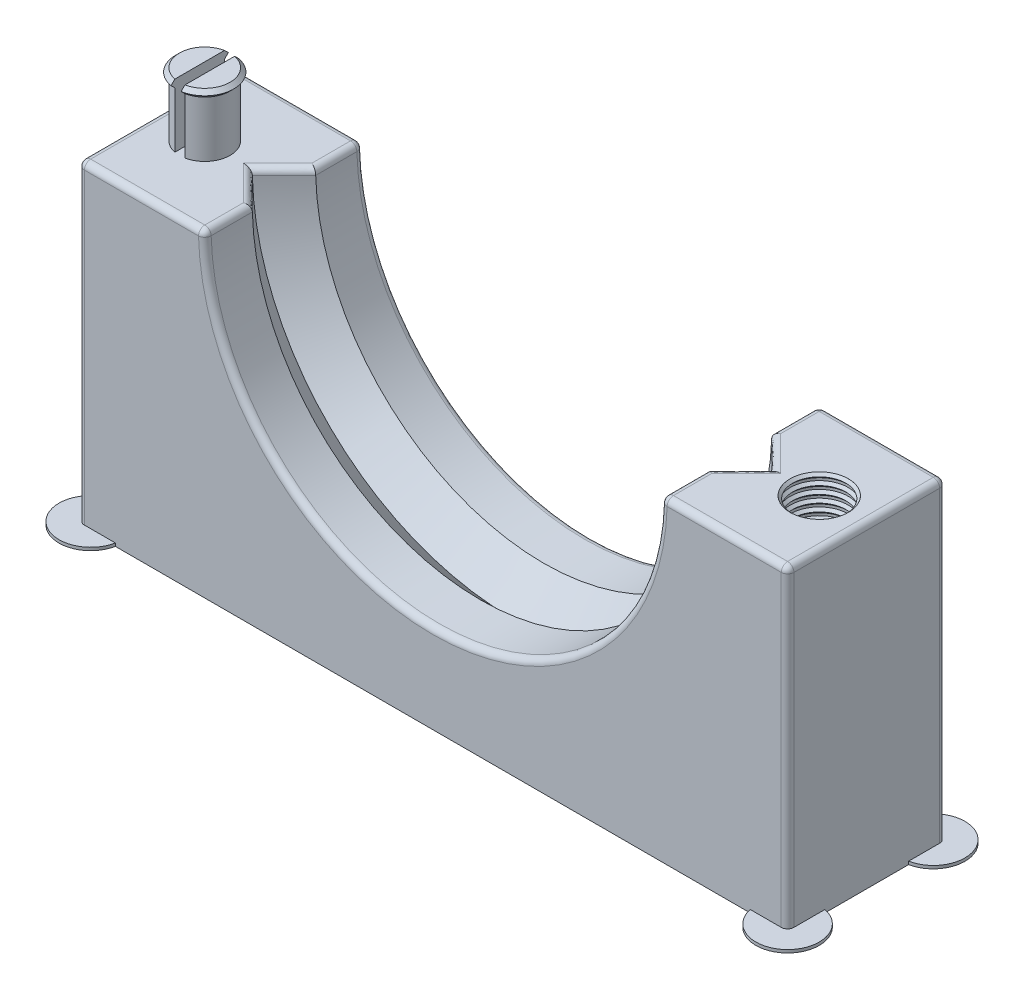
from build123d import *

# Parameters (mm, degrees)
BOSS_EXTRUDE1_DEPTH = 15.875
SKETCH6_R           = 2.921
CUT_EXTRUDE2_DEPTH  = 9.525
CUT_EXTRUDE3_REACH  = 56.481
SKETCH16_W          = 1.016
SKETCH16_H          = 11.1836739
FILLET1_R           = 0.635
SKETCH17_R          = 3.175
BOSS_EXTRUDE2_DEPTH = 0.3


with BuildPart() as part:
    # Sketch1 → Boss-Extrude1 (new body)
    with BuildSketch(Plane.XY):
        with BuildLine():
            Line((-35.56, 0), (35.56, 0))
            Line((35.56, 0), (35.56, 31.75))
            Line((35.56, 31.75), (22.86, 31.75))
            ThreePointArc((22.86, 31.75), (0, 8.89), (-22.86, 31.75))
            Line((-22.86, 31.75), (-35.56, 31.75))
            Line((-35.56, 31.75), (-35.56, 0))
        make_face()
    extrude(amount=BOSS_EXTRUDE1_DEPTH)

    # Sketch2 → Cut-Revolve1 (revolve, cut)
    with BuildSketch(Plane(origin=(0, 31.75, 0), x_dir=(1, 0, 0), z_dir=(0, 1, 0))):
        Polygon((22.86, -11.1125), (26.035, -7.9375), (22.86, -4.7625), align=None)
    revolve(axis=Axis((0, 31.75, 0), (0, 0, 1)), mode=Mode.SUBTRACT)

    # Sketch6 → Cut-Extrude2 (cut)
    with BuildSketch(Plane(origin=(0, 31.75, 0), x_dir=(1, 0, 0), z_dir=(0, 1, 0))):
        with Locations(Location((30.7975, -7.9375, 0), (0, 0, 180))):
            Circle(SKETCH6_R)
    extrude(amount=-CUT_EXTRUDE2_DEPTH, mode=Mode.SUBTRACT)

    # Sketch15 → Revolve2 (revolve)
    with BuildSketch(Plane.XY.offset(7.9375), mode=Mode.PRIVATE) as revolve2_sk:
        Polygon((-33.3375, 31.75), (-33.3375, 37.338), (-33.7185, 37.719), (-33.3375, 38.1), (-30.7975, 38.1), (-30.7975, 31.75), align=None)
    revolve(revolve2_sk.sketch.rotate(Axis((-30.7975, 38.1, 7.9375), (0, -1, 0)), 270), axis=Axis((-30.7975, 38.1, 7.9375), (0, -1, 0)))

    # Cut-Extrude3: up to this face of the body (flat: up to its plane)
    cut_extrude3_end = Plane(part.part.faces().sort_by_distance((-29.21, 31.75, 0.203299195))[0])
    # Sketch16 → Cut-Extrude3 (cut, up to the picked face)
    with BuildSketch(Plane(origin=(0, 38.1, 0), x_dir=(1, 0, 0), z_dir=(0, 1, 0)), mode=Mode.PRIVATE) as cut_extrude3_sk1:
        with Locations((-30.7975, -7.9375)):
            Rectangle(SKETCH16_W, SKETCH16_H)
    cut_extrude3_tool1 = split(extrude(cut_extrude3_sk1.sketch, amount=-CUT_EXTRUDE3_REACH, mode=Mode.PRIVATE), bisect_by=cut_extrude3_end, keep=Keep.BOTH, mode=Mode.PRIVATE)
    add(cut_extrude3_tool1.solids().sort_by(Axis((-30.7975, 38.1, 7.9375), (0, -1, 0)))[0], mode=Mode.SUBTRACT)

    # Fillet1
    fillet1_edges = [part.edges().sort_by_distance(p)[0] for p in [
        (35.56, 15.875, 15.875),
        (-35.56, 31.75, 7.9375),
        (-22.86, 31.75, 13.49375),
        (22.86, 31.75, 13.49375),
        (35.56, 31.75, 7.9375),
        (29.21, 31.75, 15.875),
        (0, 8.89, 15.875),
        (-29.21, 31.75, 15.875),
        (-22.86, 31.75, 2.38125),
        (-24.4475, 31.75, 6.35),
        (-24.4475, 31.75, 9.525),
        (22.86, 31.75, 2.38125),
        (24.4475, 31.75, 9.525),
        (24.4475, 31.75, 6.35),
        (-35.56, 15.875, 15.875),
        (-29.21, 31.75, 0),
        (0, 8.89, 0),
        (29.21, 31.75, 0),
        (35.56, 15.875, 0),
        (-35.56, 15.875, 0),
    ]]
    fillet(fillet1_edges, radius=FILLET1_R)

    # Sketch17 → Boss-Extrude2 (add)
    with BuildSketch(Plane(origin=(0, 0, 0), x_dir=(-1, 0, 0), z_dir=(0, -1, 0))):
        with Locations((34.925, -15.24)):
            Circle(SKETCH17_R)
        with Locations((34.925, -0.635)):
            Circle(SKETCH17_R)
        with Locations((-34.925, -0.635)):
            Circle(SKETCH17_R)
        with Locations((-34.925, -15.24)):
            Circle(SKETCH17_R)
    extrude(amount=-BOSS_EXTRUDE2_DEPTH)


with BuildPart() as body_2:
    # Sketch12 → Revolve1 (revolve)
    with BuildSketch(Plane.XY.offset(7.9375), mode=Mode.PRIVATE) as revolve1_sk:
        Polygon((27.8765, 30.48), (28.1305, 30.734), (27.8765, 30.988), align=None)
        Polygon((27.8765, 31.242), (28.1305, 31.496), (27.8765, 31.75), align=None)
        Polygon((27.8765, 29.718), (28.1305, 29.972), (27.8765, 30.226), align=None)
        Polygon((27.8765, 28.956), (28.1305, 29.21), (27.8765, 29.464), align=None)
        Polygon((27.8765, 28.194), (28.1305, 28.448), (27.8765, 28.702), align=None)
        Polygon((27.8765, 27.432), (28.1305, 27.686), (27.8765, 27.94), align=None)
        Polygon((27.8765, 26.67), (28.1305, 26.924), (27.8765, 27.178), align=None)
        Polygon((27.8765, 25.908), (28.1305, 26.162), (27.8765, 26.416), align=None)
        Polygon((27.8765, 25.146), (28.1305, 25.4), (27.8765, 25.654), align=None)
        Polygon((27.8765, 24.384), (28.1305, 24.638), (27.8765, 24.892), align=None)
        Polygon((27.8765, 23.622), (28.1305, 23.876), (27.8765, 24.13), align=None)
        Polygon((27.8765, 22.86), (28.1305, 23.114), (27.8765, 23.368), align=None)
        Polygon((27.8765, 22.098), (28.1305, 22.352), (27.8765, 22.606), align=None)
        Polygon((27.8765, 21.336), (28.1305, 21.59), (27.8765, 21.844), align=None)
        Polygon((27.8765, 20.574), (28.1305, 20.828), (27.8765, 21.082), align=None)
        Polygon((27.8765, 19.812), (28.1305, 20.066), (27.8765, 20.32), align=None)
        Polygon((27.8765, 19.05), (28.1305, 19.304), (27.8765, 19.558), align=None)
        Polygon((27.8765, 18.288), (28.1305, 18.542), (27.8765, 18.796), align=None)
        Polygon((27.8765, 17.526), (28.1305, 17.78), (27.8765, 18.034), align=None)
        Polygon((27.8765, 16.764), (28.1305, 17.018), (27.8765, 17.272), align=None)
    revolve(revolve1_sk.sketch.rotate(Axis((30.7975, 31.75, 7.9375), (0, -1, 0)), 270), axis=Axis((30.7975, 31.75, 7.9375), (0, -1, 0)))


solid = Compound([part.part, body_2.part])
